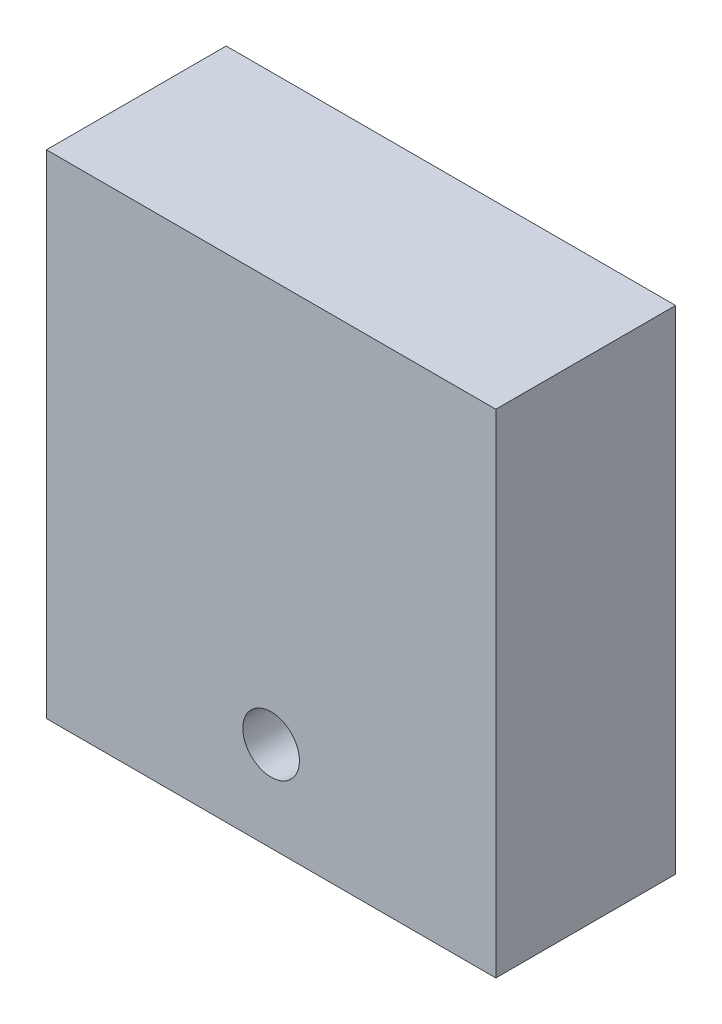
from build123d import *

# Parameters (mm, degrees)
SKETCH1_W           = 15.875
SKETCH1_H           = 17.4
BOSS_EXTRUDE1_DEPTH = 6.35
SKETCH2_R           = 1
CUT_EXTRUDE1_DEPTH  = 25.394633119


with BuildPart() as part:
    # Sketch1 → Boss-Extrude1 (new body)
    with BuildSketch(Plane.XY):
        with Locations((7.9375, 8.7)):
            Rectangle(SKETCH1_W, SKETCH1_H)
    extrude(amount=BOSS_EXTRUDE1_DEPTH)

    # Sketch2 → Cut-Extrude1 (cut, through all)
    with BuildSketch(Plane.XY.offset(6.35)):
        with Locations((7.9375, 3.175)):
            Circle(SKETCH2_R)
    extrude(amount=-CUT_EXTRUDE1_DEPTH, mode=Mode.SUBTRACT)


solid = part.part
